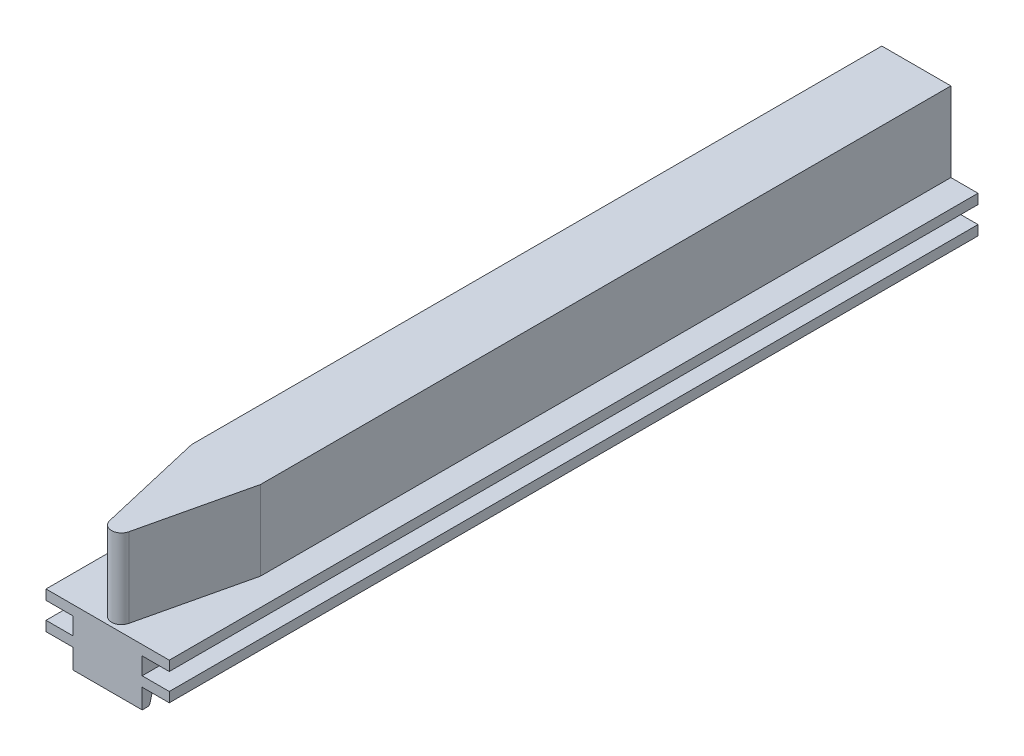
from build123d import *

# Parameters (mm, degrees)
Y_KSEKLIK_EKSTR_ZYON1_DEPTH = 170
Y_KSEKLIK_EKSTR_ZYON2_DEPTH = 14
IZIM4_W                     = 25
IZIM4_H                     = 2
Y_KSEKLIK_EKSTR_ZYON3_DEPTH = 170
L_O_ALTMA1_COUNT            = 2
L_O_ALTMA1_PITCH            = 10
IZIM6_W                     = 10
IZIM6_H                     = 20
KES_EKSTR_ZYON1_DEPTH       = 30
IZIM7_W                     = 5.5
IZIM7_H                     = 2.8
KES_EKSTR_ZYON2_DEPTH       = 179
KES_EKSTR_ZYON3_DEPTH       = 16.1
RADYUS1_R                   = 2
IZIM10_W                    = 30.056701602
IZIM10_H                    = 33.773600406
KES_EKSTR_ZYON4_DEPTH       = 6


with BuildPart() as part:
    # Çizim2 → Yükseklik-Ekstrüzyon1 (new body)
    with BuildSketch(Plane.XY):
        Polygon((19.5, 0), (25, 0), (25, 2.8), (0, 2.8), (0, 0), (5.5, 0), (5.5, -2.8), (19.5, -2.8), align=None)
    extrude(amount=Y_KSEKLIK_EKSTR_ZYON1_DEPTH)

    # Çizim3 → Yükseklik-Ekstrüzyon2 (add)
    with BuildSketch(Plane(origin=(19.5, 0, 0), x_dir=(0, 0, -1), z_dir=(1, 0, 0))):
        with BuildLine():
            Line((-170, -2.8), (0, -2.8))
            Line((0, -2.8), (0, -22.8))
            Line((0, -22.8), (-12, -22.8))
            Line((-12, -22.8), (-12.405316953, -24.421267813))
            ThreePointArc((-12.405316953, -24.421267813), (-12.582682099, -24.694102719), (-12.890388203, -24.8))
            Line((-12.890388203, -24.8), (-14.109611797, -24.8))
            ThreePointArc((-14.109611797, -24.8), (-14.417317901, -24.694102719), (-14.594683047, -24.421267813))
            Line((-14.594683047, -24.421267813), (-15, -22.8))
            Line((-15, -22.8), (-17, -22.8))
            Line((-17, -22.8), (-17.405316953, -24.421267813))
            ThreePointArc((-17.405316953, -24.421267813), (-17.582682099, -24.694102719), (-17.890388203, -24.8))
            Line((-17.890388203, -24.8), (-19.109611797, -24.8))
            ThreePointArc((-19.109611797, -24.8), (-19.417317901, -24.694102719), (-19.594683047, -24.421267813))
            Line((-19.594683047, -24.421267813), (-20, -22.8))
            Line((-20, -22.8), (-22, -22.8))
            Line((-22, -22.8), (-22.405316953, -24.421267813))
            ThreePointArc((-22.405316953, -24.421267813), (-22.582682099, -24.694102719), (-22.890388203, -24.8))
            Line((-22.890388203, -24.8), (-24.109611797, -24.8))
            ThreePointArc((-24.109611797, -24.8), (-24.417317901, -24.694102719), (-24.594683047, -24.421267813))
            Line((-24.594683047, -24.421267813), (-25, -22.8))
            Line((-25, -22.8), (-27, -22.8))
            Line((-27, -22.8), (-27.405316953, -24.421267813))
            ThreePointArc((-27.405316953, -24.421267813), (-27.582682099, -24.694102719), (-27.890388203, -24.8))
            Line((-27.890388203, -24.8), (-29.109611797, -24.8))
            ThreePointArc((-29.109611797, -24.8), (-29.417317901, -24.694102719), (-29.594683047, -24.421267813))
            Line((-29.594683047, -24.421267813), (-30, -22.8))
            Line((-30, -22.8), (-32, -22.8))
            Line((-32, -22.8), (-32.405316953, -24.421267813))
            ThreePointArc((-32.405316953, -24.421267813), (-32.582682099, -24.694102719), (-32.890388203, -24.8))
            Line((-32.890388203, -24.8), (-34.109611797, -24.8))
            ThreePointArc((-34.109611797, -24.8), (-34.417317901, -24.694102719), (-34.594683047, -24.421267813))
            Line((-34.594683047, -24.421267813), (-35, -22.8))
            Line((-35, -22.8), (-37, -22.8))
            Line((-37, -22.8), (-37.405316953, -24.421267813))
            ThreePointArc((-37.405316953, -24.421267813), (-37.582682099, -24.694102719), (-37.890388203, -24.8))
            Line((-37.890388203, -24.8), (-39.109611797, -24.8))
            ThreePointArc((-39.109611797, -24.8), (-39.417317901, -24.694102719), (-39.594683047, -24.421267813))
            Line((-39.594683047, -24.421267813), (-40, -22.8))
            Line((-40, -22.8), (-42, -22.8))
            Line((-42, -22.8), (-42.405316953, -24.421267813))
            ThreePointArc((-42.405316953, -24.421267813), (-42.582682099, -24.694102719), (-42.890388203, -24.8))
            Line((-42.890388203, -24.8), (-44.109611797, -24.8))
            ThreePointArc((-44.109611797, -24.8), (-44.417317901, -24.694102719), (-44.594683047, -24.421267813))
            Line((-44.594683047, -24.421267813), (-45, -22.8))
            Line((-45, -22.8), (-47, -22.8))
            Line((-47, -22.8), (-47.405316953, -24.421267813))
            ThreePointArc((-47.405316953, -24.421267813), (-47.582682099, -24.694102719), (-47.890388203, -24.8))
            Line((-47.890388203, -24.8), (-49.109611797, -24.8))
            ThreePointArc((-49.109611797, -24.8), (-49.417317901, -24.694102719), (-49.594683047, -24.421267813))
            Line((-49.594683047, -24.421267813), (-50, -22.8))
            Line((-50, -22.8), (-52, -22.8))
            Line((-52, -22.8), (-52.405316953, -24.421267813))
            ThreePointArc((-52.405316953, -24.421267813), (-52.582682099, -24.694102719), (-52.890388203, -24.8))
            Line((-52.890388203, -24.8), (-54.109611797, -24.8))
            ThreePointArc((-54.109611797, -24.8), (-54.417317901, -24.694102719), (-54.594683047, -24.421267813))
            Line((-54.594683047, -24.421267813), (-55, -22.8))
            Line((-55, -22.8), (-57, -22.8))
            Line((-57, -22.8), (-57.405316953, -24.421267813))
            ThreePointArc((-57.405316953, -24.421267813), (-57.582682099, -24.694102719), (-57.890388203, -24.8))
            Line((-57.890388203, -24.8), (-59.109611797, -24.8))
            ThreePointArc((-59.109611797, -24.8), (-59.417317901, -24.694102719), (-59.594683047, -24.421267813))
            Line((-59.594683047, -24.421267813), (-60, -22.8))
            Line((-60, -22.8), (-62, -22.8))
            Line((-62, -22.8), (-62.405316953, -24.421267813))
            ThreePointArc((-62.405316953, -24.421267813), (-62.582682099, -24.694102719), (-62.890388203, -24.8))
            Line((-62.890388203, -24.8), (-64.109611797, -24.8))
            ThreePointArc((-64.109611797, -24.8), (-64.417317901, -24.694102719), (-64.594683047, -24.421267813))
            Line((-64.594683047, -24.421267813), (-65, -22.8))
            Line((-65, -22.8), (-67, -22.8))
            Line((-67, -22.8), (-67.405316953, -24.421267813))
            ThreePointArc((-67.405316953, -24.421267813), (-67.582682099, -24.694102719), (-67.890388203, -24.8))
            Line((-67.890388203, -24.8), (-69.109611797, -24.8))
            ThreePointArc((-69.109611797, -24.8), (-69.417317901, -24.694102719), (-69.594683047, -24.421267813))
            Line((-69.594683047, -24.421267813), (-70, -22.8))
            Line((-70, -22.8), (-72, -22.8))
            Line((-72, -22.8), (-72.405316953, -24.421267813))
            ThreePointArc((-72.405316953, -24.421267813), (-72.582682099, -24.694102719), (-72.890388203, -24.8))
            Line((-72.890388203, -24.8), (-74.109611797, -24.8))
            ThreePointArc((-74.109611797, -24.8), (-74.417317901, -24.694102719), (-74.594683047, -24.421267813))
            Line((-74.594683047, -24.421267813), (-75, -22.8))
            Line((-75, -22.8), (-77, -22.8))
            Line((-77, -22.8), (-77.405316953, -24.421267813))
            ThreePointArc((-77.405316953, -24.421267813), (-77.582682099, -24.694102719), (-77.890388203, -24.8))
            Line((-77.890388203, -24.8), (-79.109611797, -24.8))
            ThreePointArc((-79.109611797, -24.8), (-79.417317901, -24.694102719), (-79.594683047, -24.421267813))
            Line((-79.594683047, -24.421267813), (-80, -22.8))
            Line((-80, -22.8), (-82, -22.8))
            Line((-82, -22.8), (-82.405316953, -24.421267813))
            ThreePointArc((-82.405316953, -24.421267813), (-82.582682099, -24.694102719), (-82.890388203, -24.8))
            Line((-82.890388203, -24.8), (-84.109611797, -24.8))
            ThreePointArc((-84.109611797, -24.8), (-84.417317901, -24.694102719), (-84.594683047, -24.421267813))
            Line((-84.594683047, -24.421267813), (-85, -22.8))
            Line((-85, -22.8), (-87, -22.8))
            Line((-87, -22.8), (-87.405316953, -24.421267813))
            ThreePointArc((-87.405316953, -24.421267813), (-87.582682099, -24.694102719), (-87.890388203, -24.8))
            Line((-87.890388203, -24.8), (-89.109611797, -24.8))
            ThreePointArc((-89.109611797, -24.8), (-89.417317901, -24.694102719), (-89.594683047, -24.421267813))
            Line((-89.594683047, -24.421267813), (-90, -22.8))
            Line((-90, -22.8), (-92, -22.8))
            Line((-92, -22.8), (-92.405316953, -24.421267813))
            ThreePointArc((-92.405316953, -24.421267813), (-92.582682099, -24.694102719), (-92.890388203, -24.8))
            Line((-92.890388203, -24.8), (-94.109611797, -24.8))
            ThreePointArc((-94.109611797, -24.8), (-94.417317901, -24.694102719), (-94.594683047, -24.421267813))
            Line((-94.594683047, -24.421267813), (-95, -22.8))
            Line((-95, -22.8), (-97, -22.8))
            Line((-97, -22.8), (-97.405316953, -24.421267813))
            ThreePointArc((-97.405316953, -24.421267813), (-97.582682099, -24.694102719), (-97.890388203, -24.8))
            Line((-97.890388203, -24.8), (-99.109611797, -24.8))
            ThreePointArc((-99.109611797, -24.8), (-99.417317901, -24.694102719), (-99.594683047, -24.421267813))
            Line((-99.594683047, -24.421267813), (-100, -22.8))
            Line((-100, -22.8), (-102, -22.8))
            Line((-102, -22.8), (-102.405316953, -24.421267813))
            ThreePointArc((-102.405316953, -24.421267813), (-102.582682099, -24.694102719), (-102.890388203, -24.8))
            Line((-102.890388203, -24.8), (-104.109611797, -24.8))
            ThreePointArc((-104.109611797, -24.8), (-104.417317901, -24.694102719), (-104.594683047, -24.421267813))
            Line((-104.594683047, -24.421267813), (-105, -22.8))
            Line((-105, -22.8), (-107, -22.8))
            Line((-107, -22.8), (-107.405316953, -24.421267813))
            ThreePointArc((-107.405316953, -24.421267813), (-107.582682099, -24.694102719), (-107.890388203, -24.8))
            Line((-107.890388203, -24.8), (-109.109611797, -24.8))
            ThreePointArc((-109.109611797, -24.8), (-109.417317901, -24.694102719), (-109.594683047, -24.421267813))
            Line((-109.594683047, -24.421267813), (-110, -22.8))
            Line((-110, -22.8), (-112, -22.8))
            Line((-112, -22.8), (-112.405316953, -24.421267813))
            ThreePointArc((-112.405316953, -24.421267813), (-112.582682099, -24.694102719), (-112.890388203, -24.8))
            Line((-112.890388203, -24.8), (-114.109611797, -24.8))
            ThreePointArc((-114.109611797, -24.8), (-114.417317901, -24.694102719), (-114.594683047, -24.421267813))
            Line((-114.594683047, -24.421267813), (-115, -22.8))
            Line((-115, -22.8), (-117, -22.8))
            Line((-117, -22.8), (-117.405316953, -24.421267813))
            ThreePointArc((-117.405316953, -24.421267813), (-117.582682099, -24.694102719), (-117.890388203, -24.8))
            Line((-117.890388203, -24.8), (-119.109611797, -24.8))
            ThreePointArc((-119.109611797, -24.8), (-119.417317901, -24.694102719), (-119.594683047, -24.421267813))
            Line((-119.594683047, -24.421267813), (-120, -22.8))
            Line((-120, -22.8), (-122, -22.8))
            Line((-122, -22.8), (-122.405316953, -24.421267813))
            ThreePointArc((-122.405316953, -24.421267813), (-122.582682099, -24.694102719), (-122.890388203, -24.8))
            Line((-122.890388203, -24.8), (-124.109611797, -24.8))
            ThreePointArc((-124.109611797, -24.8), (-124.417317901, -24.694102719), (-124.594683047, -24.421267813))
            Line((-124.594683047, -24.421267813), (-125, -22.8))
            Line((-125, -22.8), (-127, -22.8))
            Line((-127, -22.8), (-127.405316953, -24.421267813))
            ThreePointArc((-127.405316953, -24.421267813), (-127.582682099, -24.694102719), (-127.890388203, -24.8))
            Line((-127.890388203, -24.8), (-129.109611797, -24.8))
            ThreePointArc((-129.109611797, -24.8), (-129.417317901, -24.694102719), (-129.594683047, -24.421267813))
            Line((-129.594683047, -24.421267813), (-130, -22.8))
            Line((-130, -22.8), (-132, -22.8))
            Line((-132, -22.8), (-132.405316953, -24.421267813))
            ThreePointArc((-132.405316953, -24.421267813), (-132.582682099, -24.694102719), (-132.890388203, -24.8))
            Line((-132.890388203, -24.8), (-134.109611797, -24.8))
            ThreePointArc((-134.109611797, -24.8), (-134.417317901, -24.694102719), (-134.594683047, -24.421267813))
            Line((-134.594683047, -24.421267813), (-135, -22.8))
            Line((-135, -22.8), (-137, -22.8))
            Line((-137, -22.8), (-137.405316953, -24.421267813))
            ThreePointArc((-137.405316953, -24.421267813), (-137.582682099, -24.694102719), (-137.890388203, -24.8))
            Line((-137.890388203, -24.8), (-139.109611797, -24.8))
            ThreePointArc((-139.109611797, -24.8), (-139.417317901, -24.694102719), (-139.594683047, -24.421267813))
            Line((-139.594683047, -24.421267813), (-140, -22.8))
            Line((-140, -22.8), (-142, -22.8))
            Line((-142, -22.8), (-142.405316953, -24.421267813))
            ThreePointArc((-142.405316953, -24.421267813), (-142.582682099, -24.694102719), (-142.890388203, -24.8))
            Line((-142.890388203, -24.8), (-144.109611797, -24.8))
            ThreePointArc((-144.109611797, -24.8), (-144.417317901, -24.694102719), (-144.594683047, -24.421267813))
            Line((-144.594683047, -24.421267813), (-145, -22.8))
            Line((-145, -22.8), (-147, -22.8))
            Line((-147, -22.8), (-147.405316953, -24.421267813))
            ThreePointArc((-147.405316953, -24.421267813), (-147.582682099, -24.694102719), (-147.890388203, -24.8))
            Line((-147.890388203, -24.8), (-149.109611797, -24.8))
            ThreePointArc((-149.109611797, -24.8), (-149.417317901, -24.694102719), (-149.594683047, -24.421267813))
            Line((-149.594683047, -24.421267813), (-150, -22.8))
            Line((-150, -22.8), (-152, -22.8))
            Line((-152, -22.8), (-152.405316953, -24.421267813))
            ThreePointArc((-152.405316953, -24.421267813), (-152.582682099, -24.694102719), (-152.890388203, -24.8))
            Line((-152.890388203, -24.8), (-154.109611797, -24.8))
            ThreePointArc((-154.109611797, -24.8), (-154.417317901, -24.694102719), (-154.594683047, -24.421267813))
            Line((-154.594683047, -24.421267813), (-155, -22.8))
            Line((-155, -22.8), (-157, -22.8))
            Line((-157, -22.8), (-157.405316953, -24.421267813))
            ThreePointArc((-157.405316953, -24.421267813), (-157.582682099, -24.694102719), (-157.890388203, -24.8))
            Line((-157.890388203, -24.8), (-159.109611797, -24.8))
            ThreePointArc((-159.109611797, -24.8), (-159.417317901, -24.694102719), (-159.594683047, -24.421267813))
            Line((-159.594683047, -24.421267813), (-160, -22.8))
            Line((-160, -22.8), (-162, -22.8))
            Line((-162, -22.8), (-162.405316953, -24.421267813))
            ThreePointArc((-162.405316953, -24.421267813), (-162.582682099, -24.694102719), (-162.890388203, -24.8))
            Line((-162.890388203, -24.8), (-164.109611797, -24.8))
            ThreePointArc((-164.109611797, -24.8), (-164.417317901, -24.694102719), (-164.594683047, -24.421267813))
            Line((-164.594683047, -24.421267813), (-165, -22.8))
            Line((-165, -22.8), (-167, -22.8))
            Line((-167, -22.8), (-167.405316953, -24.421267813))
            ThreePointArc((-167.405316953, -24.421267813), (-167.582682099, -24.694102719), (-167.890388203, -24.8))
            Line((-167.890388203, -24.8), (-169.109611797, -24.8))
            ThreePointArc((-169.109611797, -24.8), (-169.417317901, -24.694102719), (-169.594683047, -24.421267813))
            Line((-169.594683047, -24.421267813), (-170, -22.8))
            Line((-170, -22.8), (-170, -2.8))
        make_face()
    y_kseklik_ekstr_zyon2 = extrude(amount=-Y_KSEKLIK_EKSTR_ZYON2_DEPTH)

    # Çizim4 → Yükseklik-Ekstrüzyon3 (add)
    with BuildSketch(Plane(origin=(0, 0, 0), x_dir=(-1, 0, 0), z_dir=(0, 0, -1))):
        with Locations((-12.5, -14.3)):
            Rectangle(IZIM4_W, IZIM4_H)
        with Locations((-12.5, -19.8)):
            Rectangle(IZIM4_W, IZIM4_H)
    extrude(amount=-Y_KSEKLIK_EKSTR_ZYON3_DEPTH)

    # LÇoğaltma1: Yükseklik-Ekstrüzyon2 ×2
    with Locations(*[(0, 0, -i * L_O_ALTMA1_PITCH) for i in range(1, L_O_ALTMA1_COUNT)]):
        add(y_kseklik_ekstr_zyon2)

    # Çizim6 → Kes-Ekstrüzyon1 (cut)
    with BuildSketch(Plane.ZY.offset(-5.5)):
        with Locations((-5, -12.8)):
            Rectangle(IZIM6_W, IZIM6_H)
    extrude(amount=-KES_EKSTR_ZYON1_DEPTH, mode=Mode.SUBTRACT)

    # Çizim7 → Kes-Ekstrüzyon2 (cut)
    with BuildSketch(Plane(origin=(0, 0, 0), x_dir=(-1, 0, 0), z_dir=(0, 0, -1))):
        with Locations((-22.25, 1.4)):
            Rectangle(IZIM7_W, IZIM7_H)
        with Locations((-2.75, 1.4)):
            Rectangle(IZIM7_W, IZIM7_H)
    extrude(amount=-KES_EKSTR_ZYON2_DEPTH, mode=Mode.SUBTRACT)

    # Çizim8 → Kes-Ekstrüzyon3 (cut)
    with BuildSketch(Plane(origin=(0, 2.8, 0), x_dir=(1, 0, 0), z_dir=(0, 1, 0))):
        Polygon((12.5, -170), (5.5, -140), (5.5, -170), align=None)
        Polygon((19.5, -140), (12.5, -170), (19.5, -170), align=None)
    extrude(amount=-KES_EKSTR_ZYON3_DEPTH, mode=Mode.SUBTRACT)

    # Radyus1
    radyus1_edges = [part.edges().sort_by_distance(p)[0] for p in [
        (12.5, -5.25, 170),
    ]]
    fillet(radyus1_edges, radius=RADYUS1_R)

    # Çizim10 → Kes-Ekstrüzyon4 (cut)
    with BuildSketch(Plane.XY.offset(170)):
        with Locations((14.667903905, -9.987813934)):
            Rectangle(IZIM10_W, IZIM10_H)
    extrude(amount=-KES_EKSTR_ZYON4_DEPTH, mode=Mode.SUBTRACT)


solid = part.part
